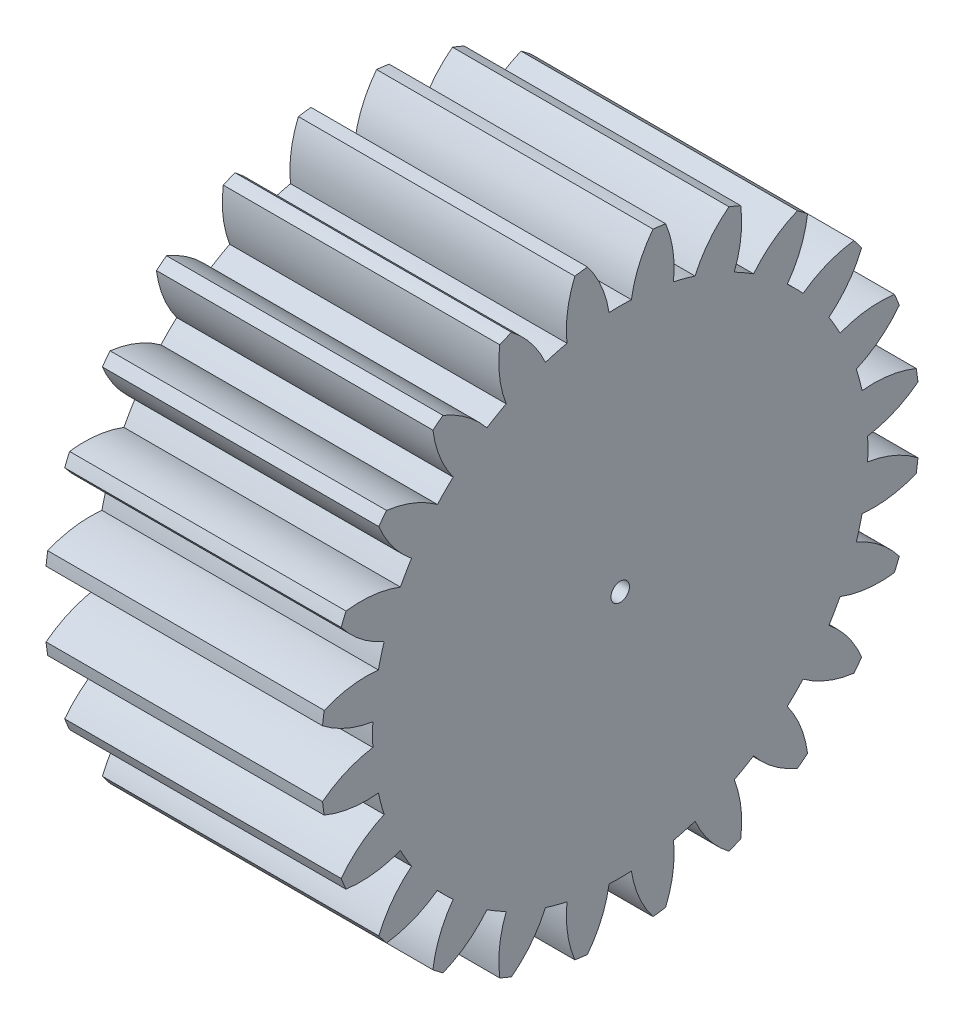
from build123d import *

# Parameters (mm, degrees)
BASPROSKE_W     = 12
BASPROSKE_H     = 13
TOOTHCUT_DEPTH  = 22.9544984
TEETHCUTS_COUNT = 24
TEETHCUTS_ANGLE = 345
BORSKE_R        = 0.4
BORE_DEPTH      = 50.0000508
SCALE1_SCALE    = 2


with BuildPart() as part:
    # BasProSke → Base-Revolve (revolve)
    with BuildSketch(Plane(origin=(0, 0, 0), x_dir=(1, 0, 0), z_dir=(0, 1, 0)), mode=Mode.PRIVATE) as base_revolve_sk:
        with Locations((6, 6.5)):
            Rectangle(BASPROSKE_W, BASPROSKE_H)
    revolve(base_revolve_sk.sketch.rotate(Axis((-10, 0, 0), (1, 0, 0)), 180), axis=Axis((-10, 0, 0), (1, 0, 0)))

    # TooCutSke → ToothCut (cut, through all)
    with BuildSketch(Plane(origin=(0, 0, 0), x_dir=(0, 0, -1), z_dir=(1, 0, 0))):
        with BuildLine():
            ThreePointArc((0.483448384, 10.738122679), (0, 10.749), (-0.483448384, 10.738122679))
            ThreePointArc((-0.483448384, 10.738122679), (-0.821636462, 11.902754369), (-1.44092227, 12.945454344))
            ThreePointArc((-1.44092227, 12.945454344), (0, 13.0254), (1.44092227, 12.945454344))
            ThreePointArc((1.44092227, 12.945454344), (0.821636462, 11.902754369), (0.483448384, 10.738122679))
        make_face()
    toothcut = extrude(amount=TOOTHCUT_DEPTH, mode=Mode.SUBTRACT)

    # TeethCuts: ToothCut ×24 about axis
    teethcuts_axis = Axis((-10, 0, 0), (1, 0, 0))
    for i in range(1, TEETHCUTS_COUNT):
        add(toothcut.rotate(teethcuts_axis, i * TEETHCUTS_ANGLE / (TEETHCUTS_COUNT - 1)), mode=Mode.SUBTRACT)

    # BorSke → Bore (cut, symmetric)
    with BuildSketch(Plane(origin=(0, 0, 0), x_dir=(0, 0, -1), z_dir=(1, 0, 0))):
        with Locations(Location((0, 0, 0), (0, 0, 180))):
            Circle(BORSKE_R)
    extrude(amount=BORE_DEPTH, both=True, mode=Mode.SUBTRACT)


with BuildPart() as part_1:
    # Scale1: scaled about (6, 0, 0)
    add(part.part.scale(SCALE1_SCALE).moved(Location((-6, 0, 0))))


solid = part_1.part
